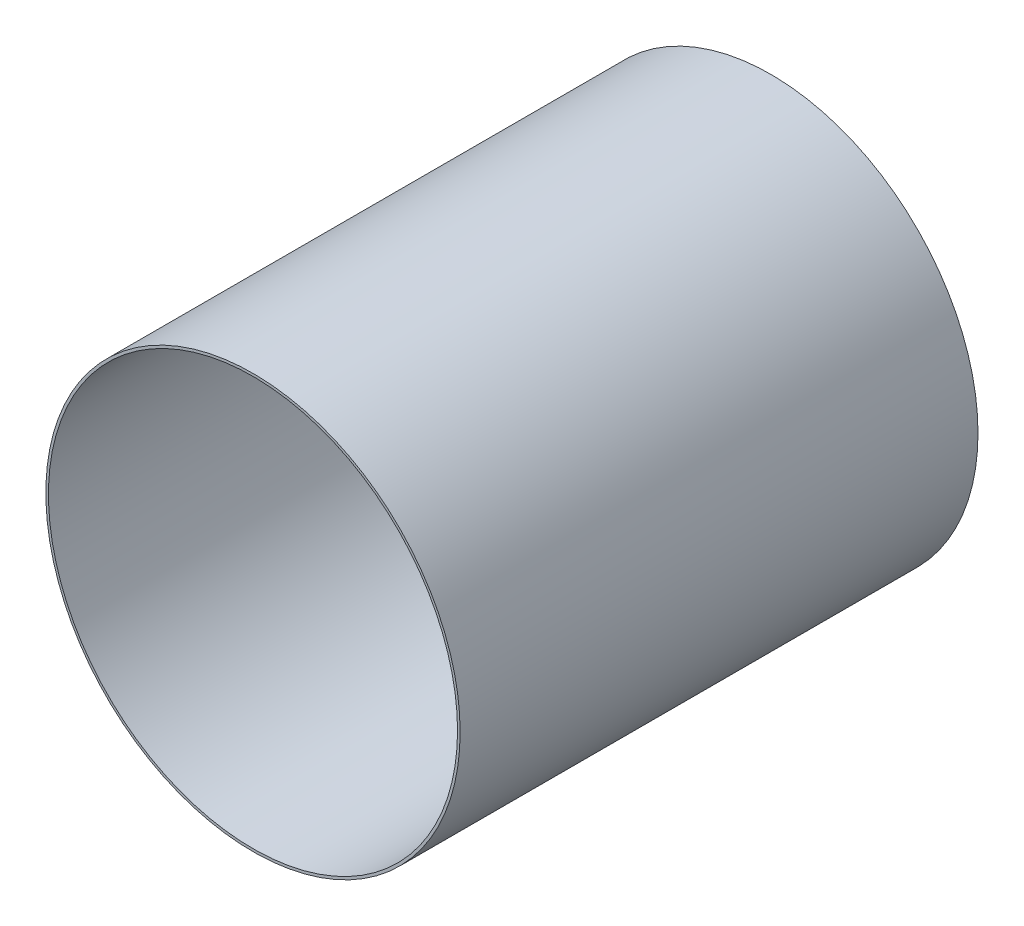
from build123d import *

# Parameters (mm, degrees)
SKETCH_1_R      = 4
SKETCH_1_R_2    = 3.95
EXTRUDE_1_DEPTH = 10


with BuildPart() as part:
    # 草图1 → 凸台-拉伸1 (new body)
    with BuildSketch(Plane.XY):
        Circle(SKETCH_1_R)
        Circle(SKETCH_1_R_2, mode=Mode.SUBTRACT)
    extrude(amount=EXTRUDE_1_DEPTH)


solid = part.part
